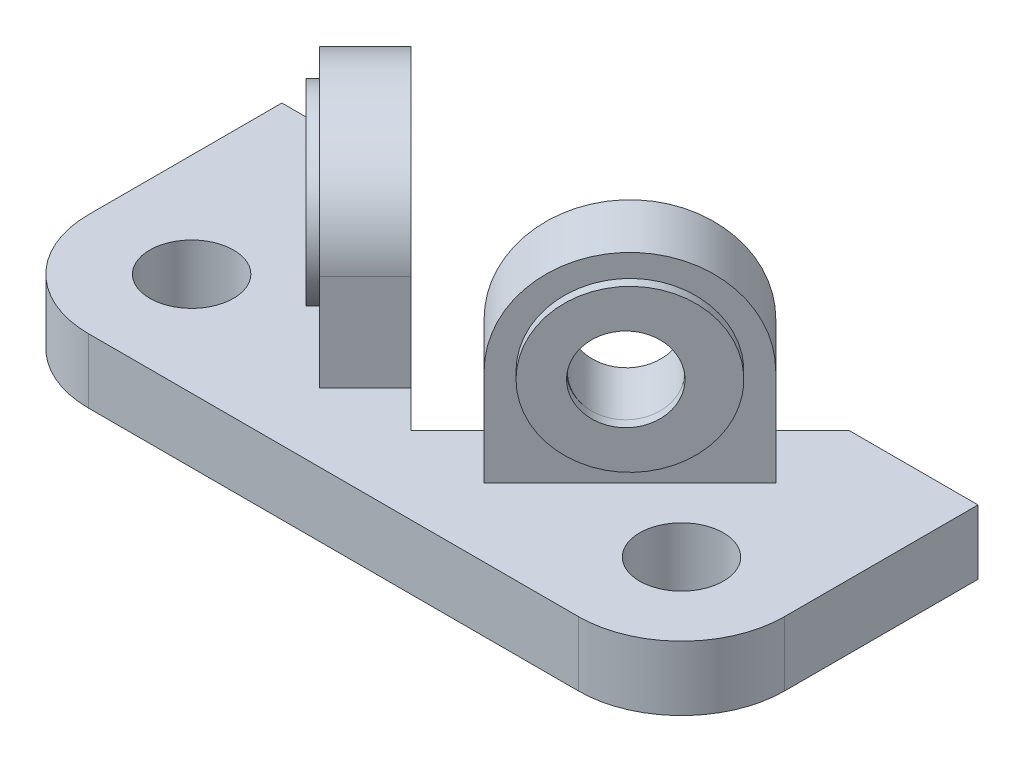
from build123d import *

# Parameters (mm, degrees)
SKETCH1_R                   = 13
BOSS_EXTRUDE1_DEPTH         = 20
BOSS_EXTRUDE2_DEPTH         = 82
FILLET1_RADIUS              = 32
FILLET1_LENGTH              = 20
SKETCH3_R                   = 25
SKETCH3_R_2                 = 13
BOSS_EXTRUDE3_DEPTH         = 3
CUT_EXTRUDE2_DEPTH          = 169.493417496
FILLET1_OF_MIRROR1_2_RADIUS = 32
FILLET1_OF_MIRROR1_2_LENGTH = 20
SKETCH5_R                   = 13
CUT_EXTRUDE3_DEPTH          = 169.493417496


with BuildPart() as part:
    # Sketch1 → Boss-Extrude1 (new body)
    with BuildSketch(Plane(origin=(0, 0, 0), x_dir=(1, 0, 0), z_dir=(0, 1, 0))):
        with BuildLine():
            Line((-68, 68), (-108, 68))
            Line((-108, 68), (-108, 8))
            ThreePointArc((-108, 8), (-98.627416998, -14.627416998), (-76, -24))
            Line((-76, -24), (-0.620811238, -24))
            Line((-0.620811238, -24), (76, -24))
            ThreePointArc((76, -24), (98.627416998, -14.627416998), (108, 8))
            Line((108, 8), (108, 68))
            Line((108, 68), (68, 68))
            Line((68, 68), (56.627416998, 56.627416998))
            Line((56.627416998, 56.627416998), (70.769552622, 42.485281374))
            Line((70.769552622, 42.485281374), (25.514718626, -2.769552622))
            Line((25.514718626, -2.769552622), (11.372583002, 11.372583002))
            Line((11.372583002, 11.372583002), (0, 0))
            Line((0, 0), (-11.372583002, 11.372583002))
            Line((-11.372583002, 11.372583002), (-25.514718626, -2.769552622))
            Line((-25.514718626, -2.769552622), (-70.769552622, 42.485281374))
            Line((-70.769552622, 42.485281374), (-56.627416998, 56.627416998))
            Line((-56.627416998, 56.627416998), (-68, 68))
        make_face()
        with Locations(Location((-76, 8, 0), (0, 0, 270))):
            Circle(SKETCH1_R, mode=Mode.SUBTRACT)
        with Locations(Location((76, 8, 0), (0, 0, 270))):
            Circle(SKETCH1_R, mode=Mode.SUBTRACT)
    extrude(amount=BOSS_EXTRUDE1_DEPTH)

    # Sketch1<3> → Boss-Extrude2 (add)
    with BuildSketch(Plane(origin=(0, 0, 0), x_dir=(1, 0, 0), z_dir=(0, 1, 0))):
        Polygon((-11.372583002, 11.372583002), (-56.627416998, 56.627416998), (-70.769552622, 42.485281374), (-25.514718626, -2.769552622), align=None)
    boss_extrude2 = extrude(amount=BOSS_EXTRUDE2_DEPTH)

    # Fillet1: full round fillet: the end face becomes a half cylinder, R = half its width
    fillet1_face = Plane((-41.071067812, 82, -26.928932188), x_dir=(0.707106781187, 0, -0.707106781187), z_dir=(0, 1, 0))  # on the end face: x along it, z out of the body
    fillet1_slab = fillet1_face.offset(-FILLET1_RADIUS / 2) * Box(FILLET1_LENGTH, 2 * FILLET1_RADIUS, FILLET1_RADIUS, mode=Mode.PRIVATE)  # the body's end, R deep
    fillet1_round = Plane((-41.071067812, 50, -26.928932188), x_dir=(0, 1, 0), z_dir=(0.707106781187, 0, -0.707106781187)) * Cylinder(FILLET1_RADIUS, FILLET1_LENGTH, mode=Mode.PRIVATE)  # its axis R under the face
    add(fillet1_slab - fillet1_round, mode=Mode.SUBTRACT)

    # Sketch3 → Boss-Extrude3 (add)
    with BuildSketch(Plane(origin=(-14.142135624, 0, 14.142135624), x_dir=(0.7071067811865487, 0, 0.7071067811865465), z_dir=(-0.7071067811865465, 0, 0.7071067811865487))):
        with Locations(Location((-48.083261121, 50, 0), (0, 0, 180))):
            Circle(SKETCH3_R)
        with Locations(Location((-47.165571339, 50, 0), (0, 0, 180))):
            Circle(SKETCH3_R_2, mode=Mode.SUBTRACT)
    boss_extrude3 = extrude(amount=BOSS_EXTRUDE3_DEPTH)

    # Sketch3<3> → Cut-Extrude2 (cut, through all)
    with BuildSketch(Plane(origin=(-14.142135624, 0, 14.142135624), x_dir=(0.7071067811865487, 0, 0.7071067811865465), z_dir=(-0.7071067811865465, 0, 0.7071067811865487))):
        with BuildLine():
            ThreePointArc((-60.165571339, 50), (-47.165571339, 37), (-34.165571339, 50))
            Line((-34.165571339, 50), (-60.165571339, 50))
        make_face()
        with BuildLine():
            Line((-60.165571339, 50), (-34.165571339, 50))
            ThreePointArc((-34.165571339, 50), (-47.165571339, 63), (-60.165571339, 50))
        make_face()
    extrude(amount=-CUT_EXTRUDE2_DEPTH, mode=Mode.SUBTRACT)

    # Mirror1: Boss-Extrude2, Boss-Extrude3 across plane
    add(boss_extrude2.mirror(Plane(origin=(0, 0, 0), x_dir=(0, 0, 1), z_dir=(1, 0, 0))))
    add(boss_extrude3.mirror(Plane(origin=(0, 0, 0), x_dir=(0, 0, 1), z_dir=(1, 0, 0))))

    # Fillet1 of Mirror1 2: full round fillet: the end face becomes a half cylinder, R = half its width
    fillet1_of_mirror1_2_face = Plane((41.071067812, 82, -26.928932188), x_dir=(-0.707106781187, 0, -0.707106781187), z_dir=(0, 1, 0))  # on the end face: x along it, z out of the body
    fillet1_of_mirror1_2_slab = fillet1_of_mirror1_2_face.offset(-FILLET1_OF_MIRROR1_2_RADIUS / 2) * Box(FILLET1_OF_MIRROR1_2_LENGTH, 2 * FILLET1_OF_MIRROR1_2_RADIUS, FILLET1_OF_MIRROR1_2_RADIUS, mode=Mode.PRIVATE)  # the body's end, R deep
    fillet1_of_mirror1_2_round = Plane((41.071067812, 50, -26.928932188), x_dir=(0, 1, 0), z_dir=(-0.707106781187, 0, -0.707106781187)) * Cylinder(FILLET1_OF_MIRROR1_2_RADIUS, FILLET1_OF_MIRROR1_2_LENGTH, mode=Mode.PRIVATE)  # its axis R under the face
    add(fillet1_of_mirror1_2_slab - fillet1_of_mirror1_2_round, mode=Mode.SUBTRACT)

    # Sketch5 → Cut-Extrude3 (cut, through all)
    with BuildSketch(Plane(origin=(14.142135624, 0, 14.142135624), x_dir=(0.7071067811865487, 0, -0.7071067811865465), z_dir=(0.7071067811865465, 0, 0.7071067811865487))):
        with Locations(Location((47.340345076, 49.832858071, 0), (0, 0, 46.811598371))):
            Circle(SKETCH5_R)
    extrude(amount=-CUT_EXTRUDE3_DEPTH, mode=Mode.SUBTRACT)


solid = part.part
